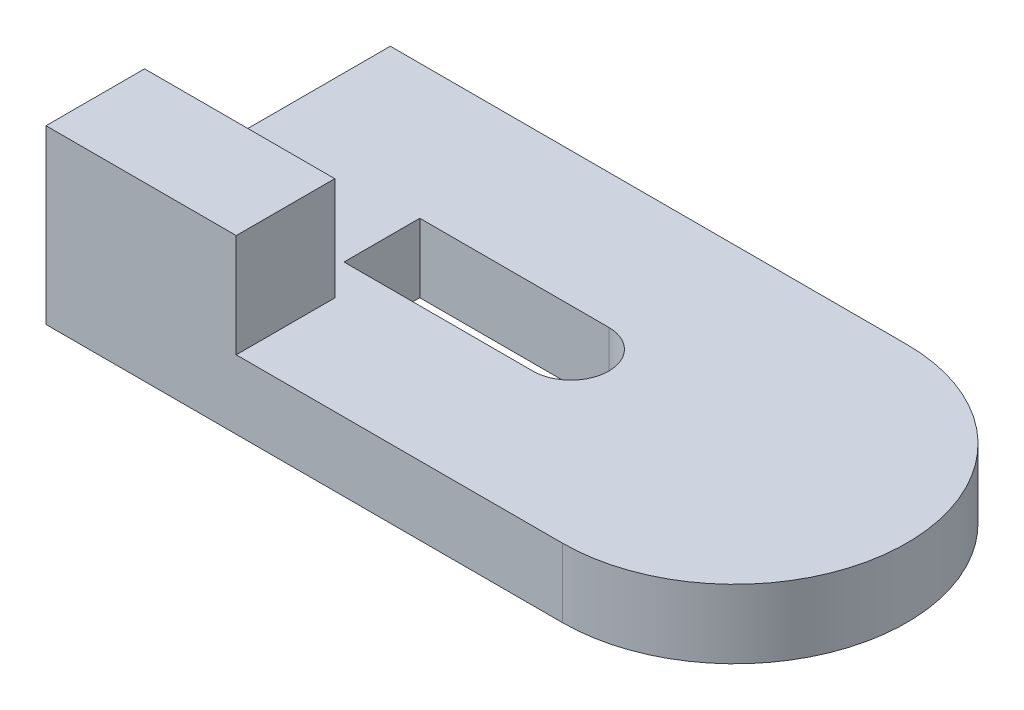
from build123d import *

# Parameters (mm, degrees)
BOSS_EXTRUDE1_DEPTH = 20
SKETCH2_W           = 55.254397281
SKETCH2_H           = 28.618836095
BOSS_EXTRUDE5_DEPTH = 30
SKETCH3_R           = 11.008857327
SKETCH3_W           = 54.887017246
SKETCH3_H           = 22.017714654
CUT_EXTRUDE1_DEPTH  = 30


with BuildPart() as part:
    # Sketch1 → Boss-Extrude1 (new body)
    with BuildSketch(Plane(origin=(0, 0, 0), x_dir=(1, 0, 0), z_dir=(0, 1, 0))):
        with BuildLine():
            Line((-75, 50), (75, 50))
            ThreePointArc((75, 50), (125, 0), (75, -50))
            Line((75, -50), (-75, -50))
            Line((-75, -50), (-75, 50))
        make_face()
    extrude(amount=BOSS_EXTRUDE1_DEPTH)

    # Sketch2 → Boss-Extrude5 (add)
    with BuildSketch(Plane(origin=(0, 20, 0), x_dir=(1, 0, 0), z_dir=(0, 1, 0))):
        with Locations((-47.37280136, -35.690581952)):
            Rectangle(SKETCH2_W, SKETCH2_H)
    extrude(amount=BOSS_EXTRUDE5_DEPTH)

    # Sketch3 → Cut-Extrude1 (cut)
    with BuildSketch(Plane(origin=(0, 20, 0), x_dir=(1, 0, 0), z_dir=(0, 1, 0))):
        with Locations((27.443508623, 0)):
            Circle(SKETCH3_R)
        Rectangle(SKETCH3_W, SKETCH3_H)
    extrude(amount=-CUT_EXTRUDE1_DEPTH, mode=Mode.SUBTRACT)


solid = part.part
